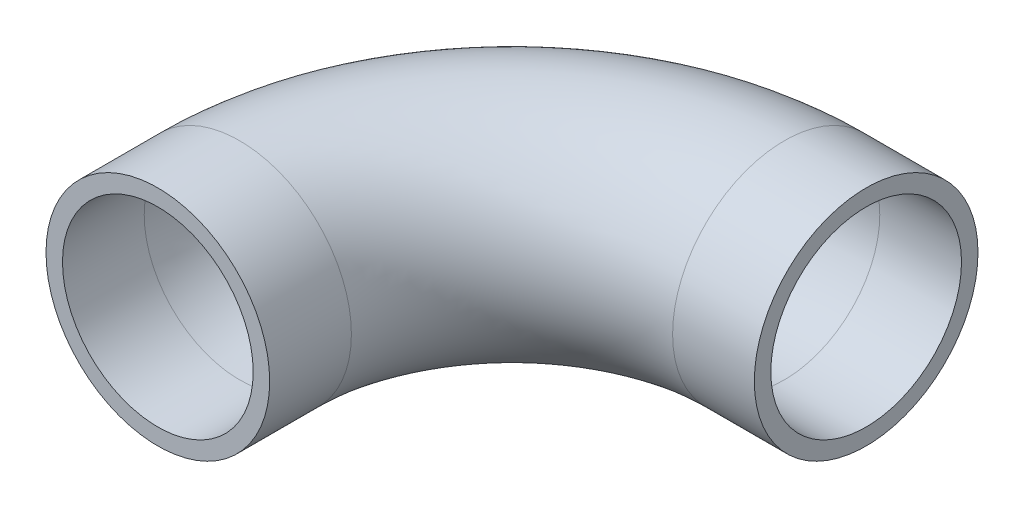
from build123d import *

# Parameters (mm, degrees)
SKETCH1_R   = 8.21
SKETCH1_R_2 = 7


with BuildPart() as part:
    # Sweep1: sweep along a path in Sketch2
    with BuildLine(Plane(origin=(0, 0, 0), x_dir=(1, 0, 0), z_dir=(0, 1, 0))) as sweep1_path:
        Line((26, 26), (20, 26))
        ThreePointArc((20, 26), (5.857864376, 20.142135624), (0, 6))
        Line((0, 6), (0, 0))
    # Sketch1 → Sweep1 (sweep)
    with BuildSketch(Plane.XY):
        Circle(SKETCH1_R)
        Circle(SKETCH1_R_2, mode=Mode.SUBTRACT)
    sweep(path=sweep1_path.line)


solid = part.part
